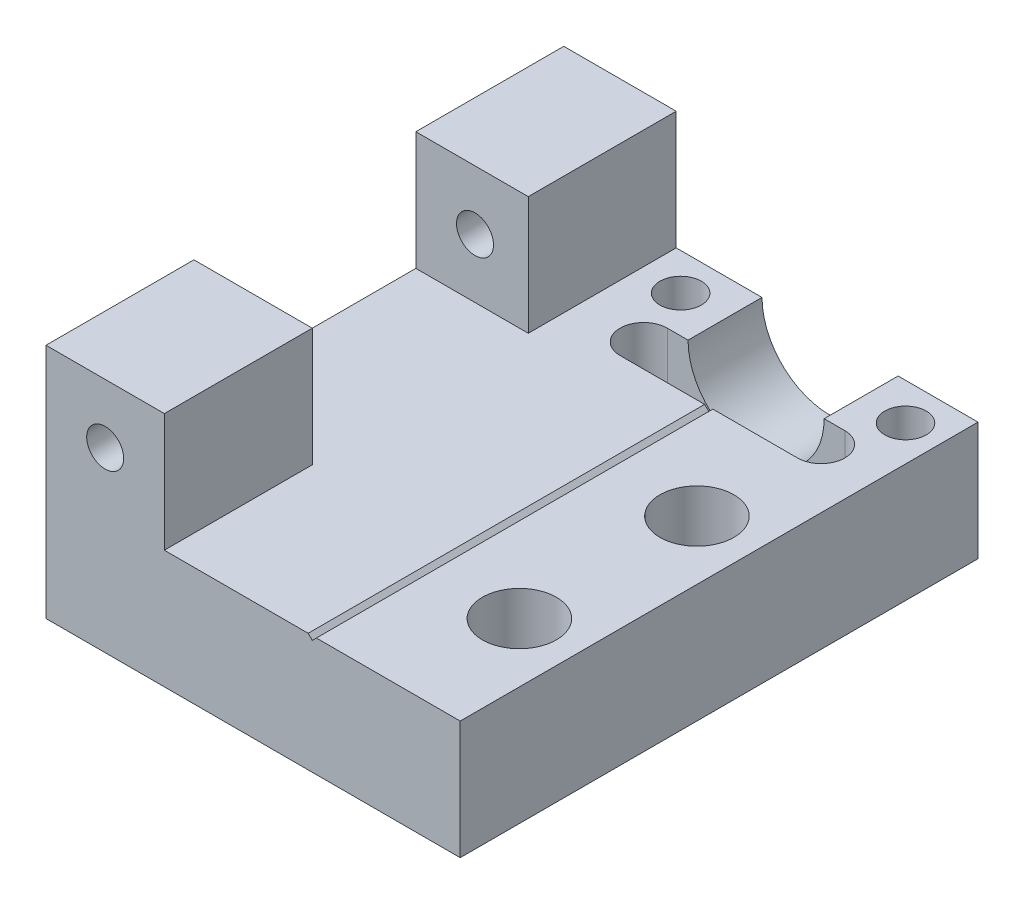
from build123d import *

# Parameters (mm, degrees)
BOSS_EXTRUDE1_DEPTH                       = 3.175
SKETCH3_W                                 = 12.7
SKETCH3_H                                 = 19.05
BOSS_EXTRUDE2_DEPTH                       = 5.08
CUT_EXTRUDE2_DEPTH                        = 27.096877687
CUT_EXTRUDE3_DEPTH                        = 27.096877687
F_2_56_TAPPED_HOLE1_D                     = 1.778
SKETCH9_W                                 = 22.225
SKETCH9_H                                 = 5.08
BOSS_EXTRUDE3_DEPTH                       = 5.08
SKETCH12_R                                = 1.5875
CUT_EXTRUDE4_DEPTH                        = 3.302
SKETCH13_W                                = 4.826
SKETCH13_H                                = 6.35
SKETCH13_W_2                              = 5.08
BOSS_EXTRUDE4_DEPTH                       = 5.08
F_1_16_0_0625_DIAMETER_HOLE1_D            = 1.5875
F_3_64_0_04688_DIAMETER_HOLE1_D           = 1.190752
F_3_64_0_04688_DIAMETER_HOLE1_ON_FACE_2_D = 1.190752


with BuildPart() as part:
    # Sketch1 → Boss-Extrude1 (new body)
    with BuildSketch(Plane.XY):
        with BuildLine():
            Line((9.271, 5.08), (12.7, 5.08))
            Line((12.7, 5.08), (12.7, 0))
            Line((12.7, 0), (0, 0))
            Line((0, 0), (0, 5.08))
            Line((0, 5.08), (3.429, 5.08))
            ThreePointArc((3.429, 5.08), (6.35, 2.159), (9.271, 5.08))
        make_face()
    extrude(amount=BOSS_EXTRUDE1_DEPTH)

    # Sketch3 → Boss-Extrude2 (add)
    with BuildSketch(Plane.XZ):
        with Locations((6.35, 12.7)):
            Rectangle(SKETCH3_W, SKETCH3_H)
    extrude(amount=-BOSS_EXTRUDE2_DEPTH)

    # Sketch7 → Cut-Extrude2 (cut, through all)
    with BuildSketch(Plane(origin=(0, 5.08, 0), x_dir=(1, 0, 0), z_dir=(0, 1, 0))):
        with BuildLine():
            Line((2.54, -3.175), (10.16, -3.175))
            ThreePointArc((10.16, -3.175), (11.176, -4.191), (10.16, -5.207))
            Line((10.16, -5.207), (2.54, -5.207))
            ThreePointArc((2.54, -5.207), (1.524, -4.191), (2.54, -3.175))
        make_face()
    extrude(amount=-CUT_EXTRUDE2_DEPTH, mode=Mode.SUBTRACT)

    # Sketch6 → Cut-Extrude3 (cut, through all)
    with BuildSketch(Plane.XY.offset(22.225)):
        Polygon((6.173223305, 5.08), (6.35, 4.903223305), (6.526776695, 5.08), align=None)
    extrude(amount=-CUT_EXTRUDE3_DEPTH, mode=Mode.SUBTRACT)

    # #2-56 Tapped Hole1 (through all)
    with Locations(Plane(origin=(11.176, 5.08, 1.5875), x_dir=(0, 0, 1), z_dir=(0, 1, 0))):
        with Locations((0, 0), (0, -9.652)):
            Hole(F_2_56_TAPPED_HOLE1_D / 2)

    # Sketch9 → Boss-Extrude3 (add)
    with BuildSketch(Plane.ZY):
        with Locations((11.1125, 2.54)):
            Rectangle(SKETCH9_W, SKETCH9_H)
    extrude(amount=BOSS_EXTRUDE3_DEPTH)

    # Sketch12 → Cut-Extrude4 (cut)
    with BuildSketch(Plane(origin=(0, 5.08, 0), x_dir=(1, 0, 0), z_dir=(0, 1, 0))):
        with Locations(Location((10.16, -17.145, 0), (0, 0, 270))):
            Circle(SKETCH12_R)
        with Locations(Location((10.16, -9.525, 0), (0, 0, 270))):
            Circle(SKETCH12_R)
    extrude(amount=-CUT_EXTRUDE4_DEPTH, mode=Mode.SUBTRACT)

    # Sketch13 → Boss-Extrude4 (add)
    with BuildSketch(Plane(origin=(0, 5.08, 0), x_dir=(1, 0, 0), z_dir=(0, 1, 0))):
        with Locations((-2.667, -3.175)):
            Rectangle(SKETCH13_W, SKETCH13_H)
        with Locations((-2.54, -19.05)):
            Rectangle(SKETCH13_W_2, SKETCH13_H)
    extrude(amount=BOSS_EXTRUDE4_DEPTH)

    # 1/16 (0.0625) Diameter Hole1 (through all)
    with Locations(Plane.XY.offset(22.225)):
        with Locations((-2.54, 7.62)):
            Hole(F_1_16_0_0625_DIAMETER_HOLE1_D / 2)

    # 3/64 (0.04688) Diameter Hole1 (through all)
    with Locations(Plane(origin=(10.16, 5.08, 17.145), x_dir=(0, 0, 1), z_dir=(0, 1, 0))):
        with Locations((0, 0)):
            Hole(F_3_64_0_04688_DIAMETER_HOLE1_D / 2)

    # 3/64 (0.04688) Diameter Hole1 on face 2 (through all)
    with Locations(Plane(origin=(10.16, 1.778, 9.525), x_dir=(0, 0, 1), z_dir=(0, 1, 0))):
        with Locations((0, 0)):
            Hole(F_3_64_0_04688_DIAMETER_HOLE1_ON_FACE_2_D / 2)


solid = part.part
